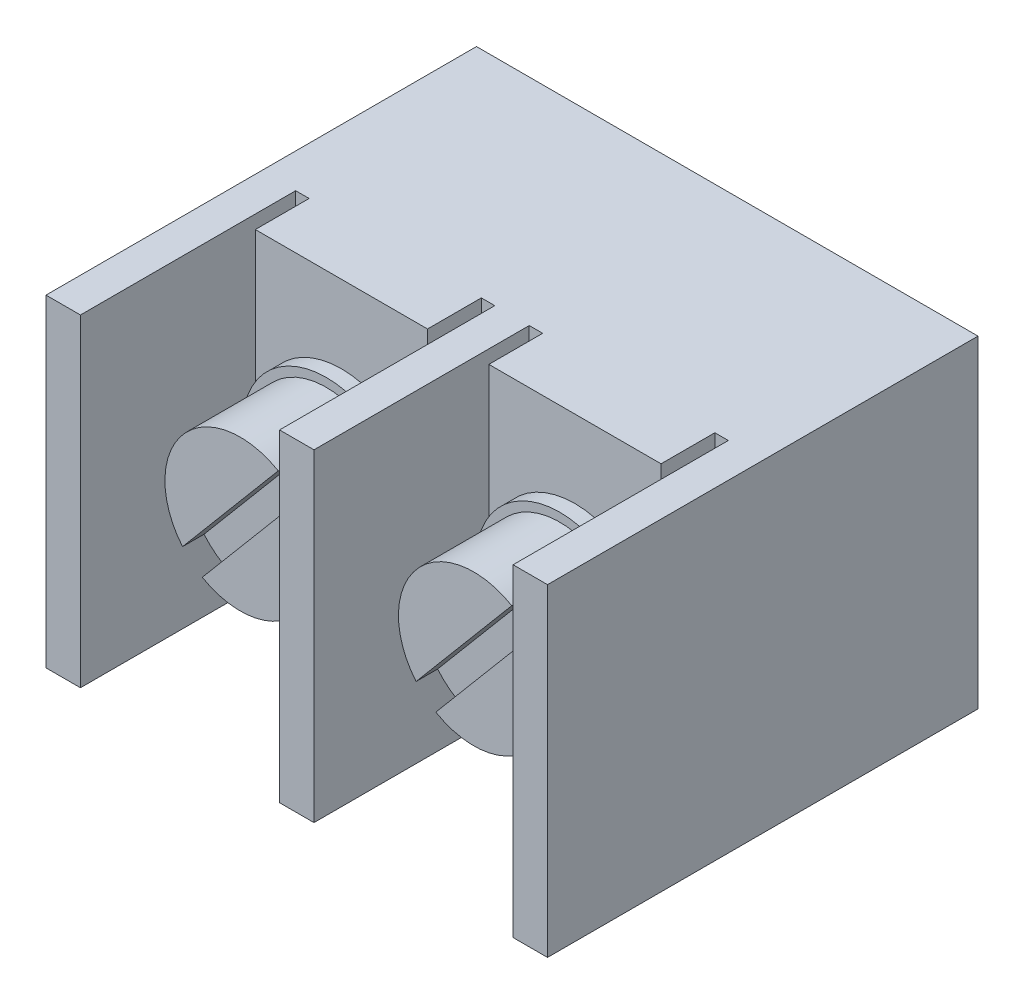
from build123d import *

# Parameters (mm, degrees)
SKETCH_1_W          = 45
SKETCH_1_H          = 15
EXTRUDE_1_DEPTH     = 10
SKETCH_2_W          = 1.6
SKETCH_2_H          = 15
EXTRUDE_2_DEPTH     = 10
SKETCH_3_W          = 8
SKETCH_3_H          = 15
EXTRUDE_3_DEPTH     = 2.5
SKETCH_4_R          = 3.9
EXTRUDE_4_DEPTH     = 0.7
SKETCH_6_R          = 3.5
EXTRUDE_5_DEPTH     = 4
CUT_EXTRUDE_START   = -1
CUT_EXTRUDE_1_DEPTH = 1
SKETCH_8_R          = 0.85
EXTRUDE_6_DEPTH     = 2.5
SKETCH_9_W          = 28.344633457
SKETCH_9_H          = 24.026198997
CUT_EXTRUDE_2_DEPTH = 21.7


with BuildPart() as part:
    # Эскиз1 → Вытянуть1 (new body)
    with BuildSketch(Plane.XY):
        Rectangle(SKETCH_1_W, SKETCH_1_H)
    extrude(amount=EXTRUDE_1_DEPTH)

    # Эскиз2 → Вытянуть2 (add)
    with BuildSketch(Plane.XY.offset(10)):
        with Locations((-21.7, 0)):
            Rectangle(SKETCH_2_W, SKETCH_2_H)
        with Locations((-10.85, 0)):
            Rectangle(SKETCH_2_W, SKETCH_2_H)
        Rectangle(SKETCH_2_W, SKETCH_2_H)
        with Locations((10.85, 0)):
            Rectangle(SKETCH_2_W, SKETCH_2_H)
        with Locations((21.7, 0)):
            Rectangle(SKETCH_2_W, SKETCH_2_H)
    extrude(amount=EXTRUDE_2_DEPTH)

    # Эскиз3 → Вытянуть3 (add)
    with BuildSketch(Plane.XY.offset(10)):
        with Locations((-16.275, 0)):
            Rectangle(SKETCH_3_W, SKETCH_3_H)
        with Locations((-5.425, 0)):
            Rectangle(SKETCH_3_W, SKETCH_3_H)
        with Locations((5.425, 0)):
            Rectangle(SKETCH_3_W, SKETCH_3_H)
        with Locations((16.275, 0)):
            Rectangle(SKETCH_3_W, SKETCH_3_H)
    extrude(amount=EXTRUDE_3_DEPTH)

    # Эскиз4 → Вытянуть4 (add)
    with BuildSketch(Plane.XY.offset(12.5)):
        with Locations(Location((-16.275, 0, 0), (0, 0, 180))):
            Circle(SKETCH_4_R)
        with Locations(Location((-5.425, 0, 0), (0, 0, 180))):
            Circle(SKETCH_4_R)
        with Locations(Location((5.425, 0, 0), (0, 0, 180))):
            Circle(SKETCH_4_R)
        with Locations(Location((16.275, 0, 0), (0, 0, 180))):
            Circle(SKETCH_4_R)
    extrude(amount=EXTRUDE_4_DEPTH)

    # Эскиз6 → Вытянуть5 (add)
    with BuildSketch(Plane.XY.offset(13.2)):
        with Locations((-16.275, 0)):
            Circle(SKETCH_6_R)
        with Locations((-5.425, 0)):
            Circle(SKETCH_6_R)
        with Locations((5.425, 0)):
            Circle(SKETCH_6_R)
        with Locations((16.275, 0)):
            Circle(SKETCH_6_R)
    extrude(amount=EXTRUDE_5_DEPTH)

    # Эскиз7 → Вырез-Вытянуть1 (cut)
    with BuildSketch(Plane.XY.offset(17.2).offset(CUT_EXTRUDE_START)):
        with BuildLine():
            Line((-14.510977508, 3.02294966), (-18.956438169, -2.24941978))
            ThreePointArc((-18.956438169, -2.24941978), (-18.531128818, -2.675795724), (-18.039022492, -3.02294966))
            Line((-18.039022492, -3.02294966), (-13.593561831, 2.24941978))
            ThreePointArc((-13.593561831, 2.24941978), (-14.018871182, 2.675795724), (-14.510977508, 3.02294966))
        make_face()
        with BuildLine():
            Line((-3.660977508, 3.02294966), (-8.106438169, -2.24941978))
            ThreePointArc((-8.106438169, -2.24941978), (-7.681128818, -2.675795724), (-7.189022492, -3.02294966))
            Line((-7.189022492, -3.02294966), (-2.743561831, 2.24941978))
            ThreePointArc((-2.743561831, 2.24941978), (-3.168871182, 2.675795724), (-3.660977508, 3.02294966))
        make_face()
        with BuildLine():
            Line((7.189022492, 3.02294966), (2.743561831, -2.24941978))
            ThreePointArc((2.743561831, -2.24941978), (3.168871182, -2.675795724), (3.660977508, -3.02294966))
            Line((3.660977508, -3.02294966), (8.106438169, 2.24941978))
            ThreePointArc((8.106438169, 2.24941978), (7.681128818, 2.675795724), (7.189022492, 3.02294966))
        make_face()
        with BuildLine():
            Line((18.039022492, 3.02294966), (13.593561831, -2.24941978))
            ThreePointArc((13.593561831, -2.24941978), (14.018871182, -2.675795724), (14.510977508, -3.02294966))
            Line((14.510977508, -3.02294966), (18.956438169, 2.24941978))
            ThreePointArc((18.956438169, 2.24941978), (18.531128818, 2.675795724), (18.039022492, 3.02294966))
        make_face()
    extrude(amount=CUT_EXTRUDE_1_DEPTH, mode=Mode.SUBTRACT)

    # Эскиз8 → Вытянуть6 (add)
    with BuildSketch(Plane(origin=(0, 0, 0), x_dir=(-1, 0, 0), z_dir=(0, 0, -1))):
        with Locations((-5, 0)):
            Circle(SKETCH_8_R)
        with Locations((5, 0)):
            Circle(SKETCH_8_R)
        with Locations((15, 0)):
            Circle(SKETCH_8_R)
        with Locations((-15, 0)):
            Circle(SKETCH_8_R)
    extrude(amount=EXTRUDE_6_DEPTH)

    # Эскиз9 → Вырез-Вытянуть2 (cut)
    with BuildSketch(Plane(origin=(22.5, 0, 0), x_dir=(0, 0, -1), z_dir=(1, 0, 0))):
        with Locations((-8.887417233, 0.294438713)):
            Rectangle(SKETCH_9_W, SKETCH_9_H)
    extrude(amount=-CUT_EXTRUDE_2_DEPTH, mode=Mode.SUBTRACT)


solid = part.part
